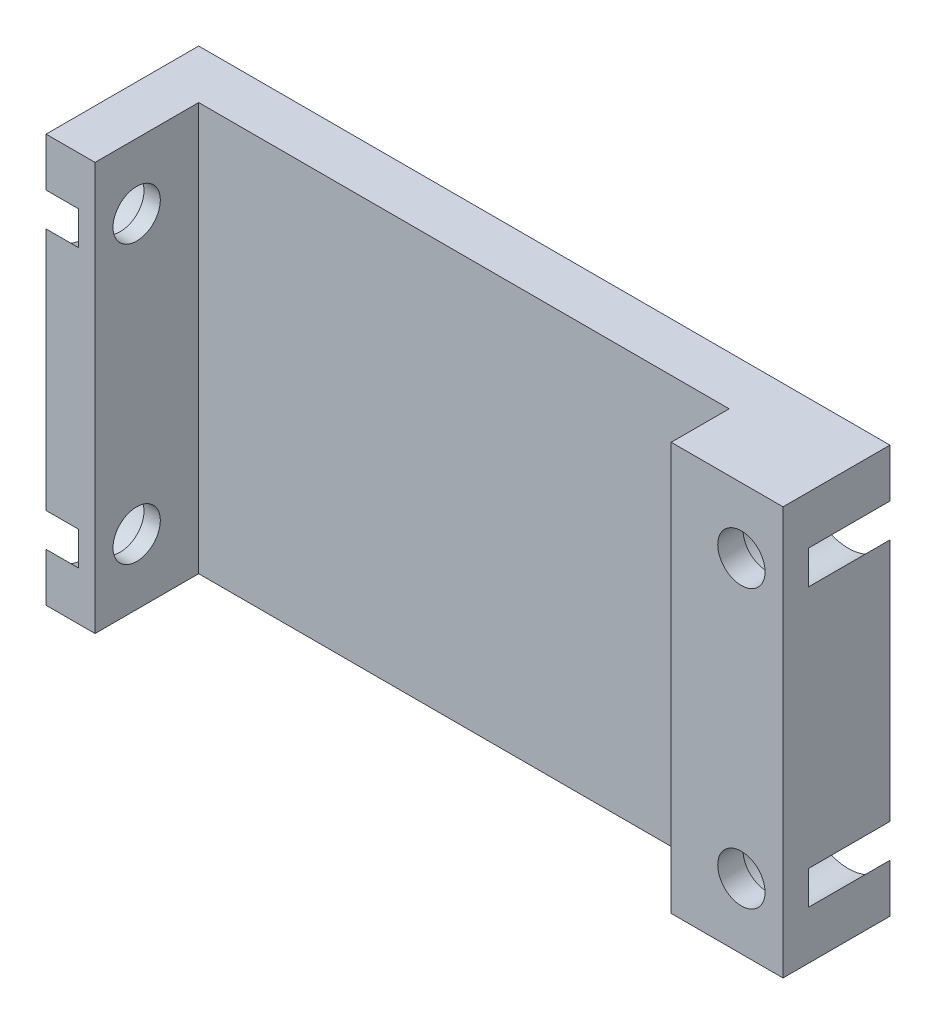
from build123d import *

# Parameters (mm, degrees)
RESSALTO_EXTRUS_O2_START         = -0.25
ESBO_O2_W                        = 6.85008846
ESBO_O2_H                        = 25
RESSALTO_EXTRUS_O2_DEPTH         = 3.55
ESBO_O3_W                        = 39.35008846
ESBO_O3_H                        = 25
RESSALTO_EXTRUS_O3_DEPTH         = 3
ESBO_O4_W                        = 9.35
ESBO_O4_H                        = 25
RESSALTO_EXTRUS_O4_DEPTH         = 3
CBORE_FOR_M2_5_SHCS2_D           = 2.9
CBORE_FOR_M2_5_SHCS2_DEPTH       = 3
CBORE_FOR_M2_5_SHCS2_CBORE_D     = 5.5
CBORE_FOR_M2_5_SHCS2_CBORE_DEPTH = 2
CBORE_FOR_M2_5_SHCS2_TIP         = 0.871247898
CBORE_FOR_M2_5_SHCS3_D           = 2.9
CBORE_FOR_M2_5_SHCS3_CBORE_D     = 5.5
CBORE_FOR_M2_5_SHCS3_CBORE_DEPTH = 5


with BuildPart() as part:
    # Esboço2 → Ressalto-extrusão2 (new body)
    with BuildSketch(Plane.XY.offset(RESSALTO_EXTRUS_O2_START)):
        with Locations((1.92504423, -10)):
            Rectangle(ESBO_O2_W, ESBO_O2_H)
    extrude(amount=-RESSALTO_EXTRUS_O2_DEPTH)

    # Esboço3 → Ressalto-extrusão3 (add)
    with BuildSketch(Plane(origin=(0, 0, -3.8), x_dir=(-1, 0, 0), z_dir=(0, 0, -1))):
        with Locations((14.32495577, -10)):
            Rectangle(ESBO_O3_W, ESBO_O3_H)
    extrude(amount=RESSALTO_EXTRUS_O3_DEPTH)

    # Esboço4 → Ressalto-extrusão4 (add)
    with BuildSketch(Plane.ZY.offset(34)):
        with Locations((-2.125, -10)):
            Rectangle(ESBO_O4_W, ESBO_O4_H)
    extrude(amount=RESSALTO_EXTRUS_O4_DEPTH)

    # CBORE for M2.5 SHCS2
    with Locations(Plane(origin=(-37, -1.5, 0), x_dir=(0, 0, -1), z_dir=(-1, 0, 0))):
        with Locations((0, 0), (0, 17)):
            CounterBoreHole(CBORE_FOR_M2_5_SHCS2_D / 2, CBORE_FOR_M2_5_SHCS2_CBORE_D / 2, CBORE_FOR_M2_5_SHCS2_CBORE_DEPTH, depth=CBORE_FOR_M2_5_SHCS2_DEPTH)
            with Locations((0, 0, -(CBORE_FOR_M2_5_SHCS2_DEPTH + CBORE_FOR_M2_5_SHCS2_TIP / 2))):  # 118° drill point
                Cone(0, CBORE_FOR_M2_5_SHCS2_D / 2, CBORE_FOR_M2_5_SHCS2_TIP, mode=Mode.SUBTRACT)

    # CBORE for M2.5 SHCS3 (through all)
    with Locations(Plane(origin=(0, 0, -6.8), x_dir=(-1, 0, 0), z_dir=(0, 0, -1))):
        with Locations((-2.8, -1.5), (-2.8, -18.5)):
            CounterBoreHole(CBORE_FOR_M2_5_SHCS3_D / 2, CBORE_FOR_M2_5_SHCS3_CBORE_D / 2, CBORE_FOR_M2_5_SHCS3_CBORE_DEPTH)


solid = part.part
